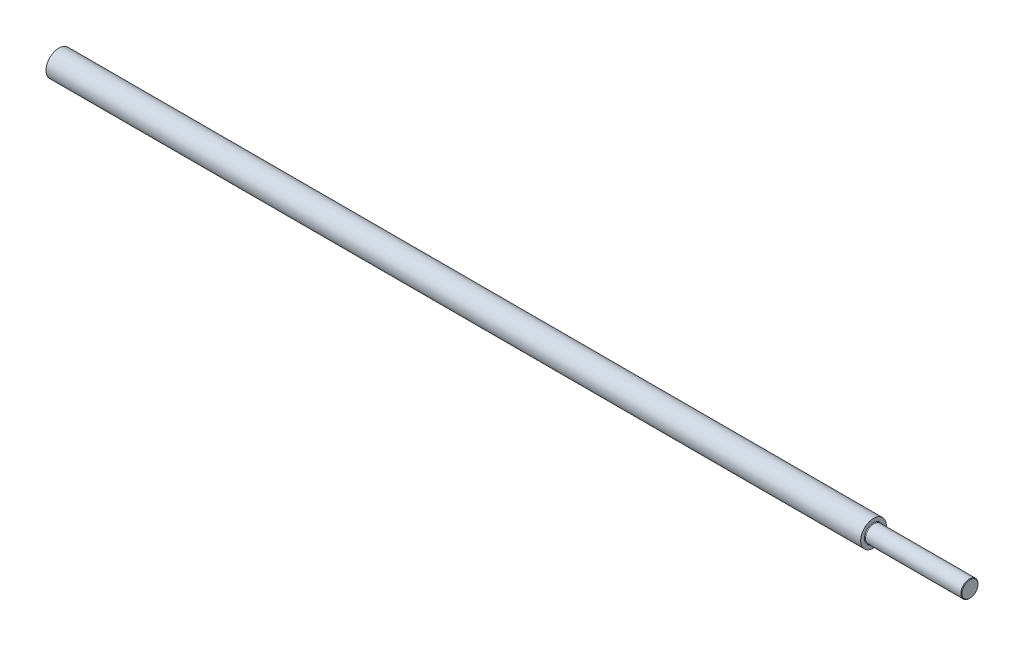
from build123d import *


with BuildPart() as part:
    # Sketch1 → Revolve1 (revolve)
    with BuildSketch(Plane.XY, mode=Mode.PRIVATE) as revolve1_sk:
        with BuildLine():
            Line((0, 0), (0, 6))
            Line((0, 6), (380, 6))
            Line((380, 6), (380, 4.3))
            ThreePointArc((380, 4.3), (380.087867966, 4.087867966), (380.3, 4))
            Line((380.3, 4), (424.733333333, 4))
            Line((424.733333333, 4), (425, 3.733333333))
            Line((425, 3.733333333), (425, 0))
            Line((425, 0), (0, 0))
        make_face()
    revolve(revolve1_sk.sketch.rotate(Axis((425, 0, 0), (-1, 0, 0)), 180), axis=Axis((425, 0, 0), (-1, 0, 0)))


solid = part.part
